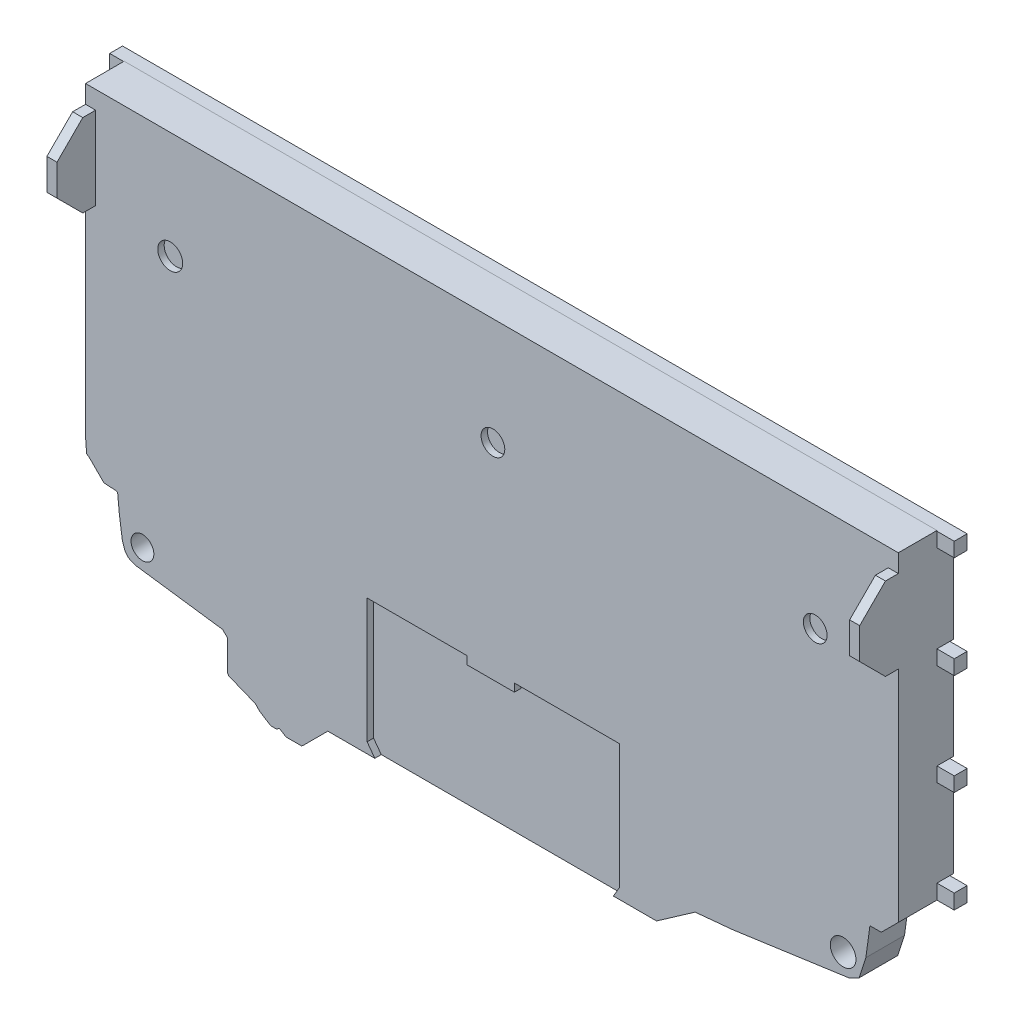
from build123d import *

# Parameters (mm, degrees)
CONTOURS_R              = 0.996805003
CONTOURS_R_2            = 0.884493699
CONTOURS_R_3            = 0.969462683
CONTOURS_R_4            = 0.92016771
BOSS_EXTRU_1_DEPTH      = 3
ENL_V_MAT_EXTRU_3_DEPTH = 0.5
ESQUISSE6_R             = 0.92016771
ESQUISSE6_R_2           = 0.969462683
BOSS_EXTRU_2_DEPTH      = 2.5
ESQUISSE7_W             = 65.577757284
ESQUISSE7_H             = 1.135573616
ESQUISSE7_W_2           = 65.714172828
ESQUISSE7_H_2           = 1.121624069
ESQUISSE7_H_3           = 1.147393865
BOSS_EXTRU_3_DEPTH      = 1
ESQUISSE8_W             = 63.110312129
ESQUISSE8_H             = 6.788838012
ESQUISSE8_H_2           = 6.737736788
ESQUISSE8_H_3           = 6.757335266
BOSS_EXTRU_4_DEPTH      = 1.3
ESQUISSE12_W            = 0.779629517
ESQUISSE12_H            = 6.41876269
ESQUISSE12_W_2          = 0.785524209
BOSS_EXTRU_6_DEPTH      = 3
CHANFREIN1_SIZE         = 2
CHANFREIN2_SIZE         = 2


with BuildPart() as part:
    # Contours → Boss.-Extru.1 (new body)
    with BuildSketch(Plane.XY):
        with BuildLine():
            Line((-13.53709508, 8.689037277), (49.427183341, 8.689037277))
            Line((49.427183341, 8.689037277), (49.427183341, -15.576035195))
            Line((49.427183341, -15.576035195), (49.427183341, -16.167014971))
            Line((49.427183341, -16.167014971), (48.103014513, -17.491183799))
            Line((48.103014513, -17.491183799), (47.222080517, -17.491183799))
            Line((47.222080517, -17.491183799), (46.905484209, -19.797319309))
            Line((46.905484209, -19.797319309), (46.377823694, -21.422513692))
            Line((46.377823694, -21.422513692), (45.61180941, -21.813030779))
            Line((45.61180941, -21.813030779), (43.444031236, -22.119025571))
            Line((43.444031236, -22.119025571), (40.627206664, -22.516637126))
            Line((40.627206664, -22.516637126), (36.607696599, -23.084014896))
            Line((36.607696599, -23.084014896), (33.650652093, -23.364304384))
            Line((33.650652093, -23.364304384), (30.65446793, -25.457235805))
            Line((30.65446793, -25.457235805), (5.129220902, -25.457235805))
            Line((5.129220902, -25.457235805), (3.210082619, -27.376374088))
            Line((3.210082619, -27.376374088), (3.086468117, -27.469210212))
            Line((3.086468117, -27.469210212), (1.882461508, -27.469210212))
            Line((1.882461508, -27.469210212), (1.368391271, -27.144534273))
            Line((1.368391271, -27.144534273), (1.152232663, -27.306872243))
            Line((1.152232663, -27.306872243), (0.691983064, -27.306872243))
            Line((0.691983064, -27.306872243), (-0.167684887, -26.763924063))
            Line((-0.167684887, -26.763924063), (-0.49849538, -26.416804947))
            Line((-0.49849538, -26.416804947), (-2.55477633, -25.588795397))
            Line((-2.55477633, -25.588795397), (-2.653579321, -25.457235805))
            Line((-2.653579321, -25.457235805), (-2.653579321, -23.084014896))
            Line((-2.653579321, -23.084014896), (-3.036044011, -22.701550207))
            Line((-3.036044011, -22.701550207), (-9.780970444, -21.775577383))
            Line((-9.780970444, -21.775577383), (-10.358479282, -21.543029961))
            Line((-10.358479282, -21.543029961), (-10.639580473, -21.168734027))
            Line((-10.639580473, -21.168734027), (-10.823901747, -20.609916501))
            Line((-10.823901747, -20.609916501), (-10.916488176, -19.954000633))
            Line((-10.916488176, -19.954000633), (-11.060291782, -18.935243689))
            Line((-11.060291782, -18.935243689), (-11.184195314, -17.628065669))
            ThreePointArc((-11.184195314, -17.628065669), (-11.230466887, -17.54072814), (-11.324942788, -17.511690124))
            Line((-11.324942788, -17.511690124), (-12.261208369, -17.442093435))
            Line((-12.261208369, -17.442093435), (-12.746327303, -16.956974502))
            Line((-12.746327303, -16.956974502), (-13.411955607, -16.291346198))
            Line((-13.411955607, -16.291346198), (-13.59975919, -16.167014971))
            Line((-13.59975919, -16.167014971), (-13.683128788, -15.023442521))
            Line((-13.683128788, -15.023442521), (-13.683128788, 8.689037277))
            Line((-13.683128788, 8.689037277), (-13.53709508, 8.689037277))
        make_face()
        with Locations((45.140288013, -20.300965513)):
            Circle(CONTOURS_R, mode=Mode.SUBTRACT)
        with Locations((-9.263810849, -20.300965513)):
            Circle(CONTOURS_R_2, mode=Mode.SUBTRACT)
        with Locations((-7.107072771, 0.361135268)):
            Circle(CONTOURS_R_3, mode=Mode.SUBTRACT)
        with Locations((17.950565341, 0.361135268)):
            Circle(CONTOURS_R_4, mode=Mode.SUBTRACT)
        with Locations((42.975492251, 0.361135268)):
            Circle(CONTOURS_R_4, mode=Mode.SUBTRACT)
    extrude(amount=BOSS_EXTRU_1_DEPTH)

    # Esquisse5 → Enlèv. mat.-Extru.3 (cut)
    with BuildSketch(Plane.XY.offset(3)):
        Polygon((8.181753212, -14.974213956), (15.937864767, -14.974213956), (15.937864767, -15.592047706), (19.619809184, -15.592047706), (19.619809184, -14.974213956), (27.772380941, -14.974213956), (27.772380941, -24.647748669), (27.308611889, -25.457235805), (8.782258705, -25.457235805), (8.181753212, -24.647748669), align=None)
    extrude(amount=-ENL_V_MAT_EXTRU_3_DEPTH, mode=Mode.SUBTRACT)

    # Esquisse6 → Boss.-Extru.2 (add)
    with BuildSketch(Plane.XY):
        with Locations((42.975492251, 0.361135268)):
            Circle(ESQUISSE6_R)
        with Locations((17.950565341, 0.361135268)):
            Circle(ESQUISSE6_R)
        with Locations((-7.107072771, 0.361135268)):
            Circle(ESQUISSE6_R_2)
    extrude(amount=BOSS_EXTRU_2_DEPTH)

    # Esquisse7 → Boss.-Extru.3 (add)
    with BuildSketch(Plane.XY):
        Polygon((-14.80971951, 8.646615937), (50.768037774, 8.635168208), (50.768037774, 7.517857947), (-14.80971951, 7.517857947), align=None)
        with Locations((17.979159132, 0.161233127)):
            Rectangle(ESQUISSE7_W, ESQUISSE7_H)
        with Locations((17.91095136, -7.705102504)):
            Rectangle(ESQUISSE7_W_2, ESQUISSE7_H_2)
        with Locations((17.91095136, -15.596946737)):
            Rectangle(ESQUISSE7_W_2, ESQUISSE7_H_3)
    extrude(amount=-BOSS_EXTRU_3_DEPTH)

    # Esquisse8 → Boss.-Extru.4 (add)
    with BuildSketch(Plane(origin=(0, 0, 0), x_dir=(-1, 0, 0), z_dir=(0, 0, -1))):
        with Locations((-17.872027276, 4.123438941)):
            Rectangle(ESQUISSE8_W, ESQUISSE8_H)
        with Locations((-17.872027276, -3.775422075)):
            Rectangle(ESQUISSE8_W, ESQUISSE8_H_2)
        with Locations((-17.872027276, -11.644582171)):
            Rectangle(ESQUISSE8_W, ESQUISSE8_H_3)
        with BuildLine():
            Line((-39.947601393, -16.170643669), (3.467572619, -16.170643669))
            Line((3.467572619, -16.170643669), (6.662365967, -16.170643669))
            Line((6.662365967, -16.170643669), (2.928932188, -19.904077448))
            ThreePointArc((2.928932188, -19.904077448), (-0.3153013, -22.071804962), (-4.142135624, -22.833009637))
            Line((-4.142135624, -22.833009637), (-28.712150945, -22.833009637))
            ThreePointArc((-28.712150945, -22.833009637), (-32.297105816, -22.168324231), (-35.405487251, -20.262629351))
            Line((-35.405487251, -20.262629351), (-39.947601393, -16.170643669))
        make_face()
    extrude(amount=BOSS_EXTRU_4_DEPTH)

    # Esquisse12 → Boss.-Extru.6 (add)
    with BuildSketch(Plane.XY.offset(3)):
        with Locations((49.037368583, 4.079655932)):
            Rectangle(ESQUISSE12_W, ESQUISSE12_H)
        with Locations((-13.290366684, 4.079655932)):
            Rectangle(ESQUISSE12_W_2, ESQUISSE12_H)
    extrude(amount=BOSS_EXTRU_6_DEPTH)

    # Chanfrein1
    chanfrein1_edges = [part.edges().sort_by_distance(p)[0] for p in [
        (49.037368582, 7.289037277, 6),
        (49.037368582, 0.870274587, 6),
    ]]
    chamfer(chanfrein1_edges, length=CHANFREIN1_SIZE)

    # Chanfrein2
    chanfrein2_edges = [part.edges().sort_by_distance(p)[0] for p in [
        (-13.290366684, 7.289037277, 6),
        (-13.290366684, 0.870274587, 6),
    ]]
    chamfer(chanfrein2_edges, length=CHANFREIN2_SIZE)


solid = part.part
